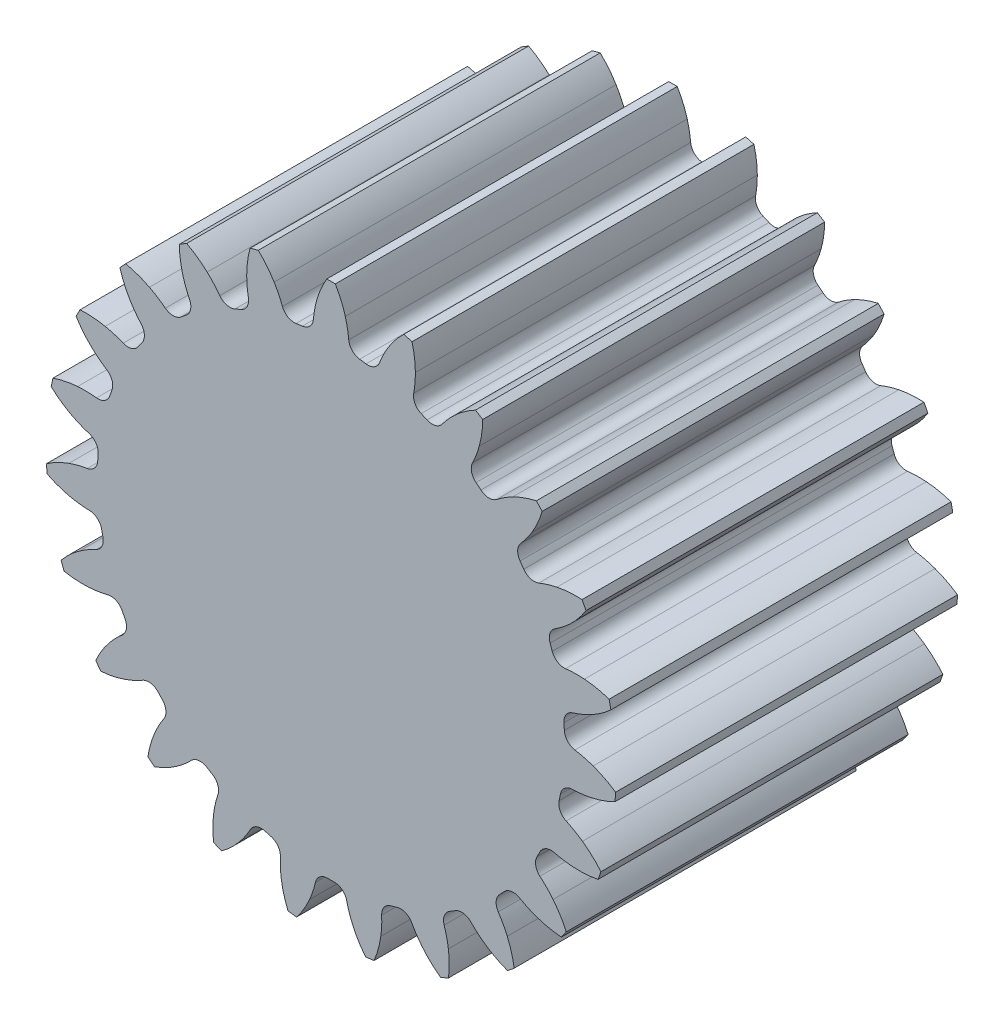
from build123d import *

# Parameters (mm, degrees)
BOSS_EXTRUDE1_DEPTH = 60


with BuildPart() as part:
    # Sketch1 → Boss-Extrude1 (new body)
    with BuildSketch(Plane.XY):
        with BuildLine():
            ThreePointArc((-5.026149362, 40.690758442), (-5.582832613, 40.618123787), (-6.138469134, 40.537873608))
            ThreePointArc((-6.138469134, 40.537873608), (-7.575957247, 40.812524235), (-8.523084033, 41.928210523))
            ThreePointArc((-8.523084033, 41.928210523), (-9.185611931, 43.449347612), (-9.985016116, 44.903223194))
            ThreePointArc((-9.985016116, 44.903223194), (-11.262557951, 46.714390419), (-12.7661329, 48.342795231))
            ThreePointArc((-12.7661329, 48.342795231), (-13.489838558, 48.145864367), (-14.210508831, 47.938100075))
            ThreePointArc((-14.210508831, 47.938100075), (-14.64909944, 45.765525993), (-14.799602552, 43.554239338))
            ThreePointArc((-14.799602552, 43.554239338), (-14.727218582, 41.896662245), (-14.502936857, 40.252734337))
            ThreePointArc((-14.502936857, 40.252734337), (-14.732487673, 38.807358447), (-15.818001353, 37.82579587))
            ThreePointArc((-15.818001353, 37.82579587), (-16.334444684, 37.605663362), (-16.847825456, 37.378480138))
            ThreePointArc((-16.847825456, 37.378480138), (-18.306107463, 37.255116323), (-19.519120776, 38.073898188))
            ThreePointArc((-19.519120776, 38.073898188), (-20.567478217, 39.359879499), (-21.729489264, 40.544164763))
            ThreePointArc((-21.729489264, 40.544164763), (-23.448303452, 41.943492333), (-25.335460124, 43.10585181))
            ThreePointArc((-25.335460124, 43.10585181), (-25.979197502, 42.720970227), (-26.617089231, 42.326475885))
            ThreePointArc((-26.617089231, 42.326475885), (-26.453262238, 40.116136414), (-26.001586287, 37.946245013))
            ThreePointArc((-26.001586287, 37.946245013), (-25.484677563, 36.369664336), (-24.825186371, 34.84720822))
            ThreePointArc((-24.825186371, 34.84720822), (-24.656267072, 33.393498719), (-25.436704546, 32.15546706))
            ThreePointArc((-25.436704546, 32.15546706), (-25.874605717, 31.804162919), (-26.307655638, 31.44689579))
            ThreePointArc((-26.307655638, 31.44689579), (-27.678577433, 30.934666863), (-29.067513626, 31.395819))
            ThreePointArc((-29.067513626, 31.395819), (-30.423948735, 32.351269184), (-31.8623856, 33.178131109))
            ThreePointArc((-31.8623856, 33.178131109), (-33.894995555, 34.061837298), (-36.025772173, 34.671944557))
            ThreePointArc((-36.025772173, 34.671944557), (-36.541798214, 34.127657161), (-37.049601888, 33.57569061))
            ThreePointArc((-37.049601888, 33.57569061), (-36.295507592, 31.491516517), (-35.275151316, 29.523951287))
            ThreePointArc((-35.275151316, 29.523951287), (-34.352054594, 28.145294804), (-33.30626538, 26.857224084))
            ThreePointArc((-33.30626538, 26.857224084), (-32.751403937, 25.502995957), (-33.168883729, 24.100314359))
            ThreePointArc((-33.168883729, 24.100314359), (-33.495765613, 23.643893207), (-33.81636735, 23.183039042))
            ThreePointArc((-33.81636735, 23.183039042), (-34.998253936, 22.319934679), (-36.460101965, 22.389255544))
            ThreePointArc((-36.460101965, 22.389255544), (-38.024014155, 22.94331323), (-39.632194557, 23.35142725))
            ThreePointArc((-39.632194557, 23.35142725), (-41.827850898, 23.653971614), (-44.044217507, 23.666577789))
            ThreePointArc((-44.044217507, 23.666577789), (-44.39426092, 23.003251887), (-44.734315063, 22.334749961))
            ThreePointArc((-44.734315063, 22.334749961), (-43.445881188, 20.531314903), (-41.932519745, 18.912001158))
            ThreePointArc((-41.932519745, 18.912001158), (-40.671696886, 17.833517512), (-39.317171052, 16.875362502))
            ThreePointArc((-39.317171052, 16.875362502), (-38.417519, 15.721052653), (-38.441078542, 14.257751594))
            ThreePointArc((-38.441078542, 14.257751594), (-38.632697807, 13.730064099), (-38.817073796, 13.199802344))
            ThreePointArc((-38.817073796, 13.199802344), (-39.722270051, 12.049835047), (-41.148611335, 11.722183428))
            ThreePointArc((-41.148611335, 11.722183428), (-42.804012393, 11.833756693), (-44.462664948, 11.792854858))
            ThreePointArc((-44.462664948, 11.792854858), (-46.658525889, 11.491799065), (-48.796104717, 10.905969214))
            ThreePointArc((-48.796104717, 10.905969214), (-48.954204384, 10.172800653), (-49.101288736, 9.437343082))
            ThreePointArc((-49.101288736, 9.437343082), (-47.374072528, 8.048399587), (-45.479945013, 6.89743442))
            ThreePointArc((-45.479945013, 6.89743442), (-43.97490548, 6.199109809), (-42.41210201, 5.641932483))
            ThreePointArc((-42.41210201, 5.641932483), (-41.234382427, 4.773150793), (-40.862274417, 3.357756618))
            ThreePointArc((-40.862274417, 3.357756618), (-40.904419537, 2.797938948), (-40.938895455, 2.23759669))
            ThreePointArc((-40.938895455, 2.23759669), (-41.500267113, 0.886054274), (-42.785316444, 0.185730593))
            ThreePointArc((-42.785316444, 0.185730593), (-44.409432848, -0.153455442), (-45.995542884, -0.64033963))
            ThreePointArc((-45.995542884, -0.64033963), (-48.028751463, -1.522667649), (-49.929008067, -2.663485206))
            ThreePointArc((-49.929008067, -2.663485206), (-49.88343846, -3.412120668), (-49.826644447, -4.15998836))
            ThreePointArc((-49.826644447, -4.15998836), (-47.788745631, -5.031428706), (-45.654330817, -5.628683476))
            ThreePointArc((-45.654330817, -5.628683476), (-44.016696507, -5.895057509), (-42.361521386, -6.009933859))
            ThreePointArc((-42.361521386, -6.009933859), (-40.993080344, -6.528753826), (-40.25290233, -7.791267806))
            ThreePointArc((-40.25290233, -7.791267806), (-40.142447595, -8.341696535), (-40.02446652, -8.890561273))
            ThreePointArc((-40.02446652, -8.890561273), (-40.200379215, -10.343441091), (-41.248830363, -11.364497031))
            ThreePointArc((-41.248830363, -11.364497031), (-42.721208828, -12.129286489), (-44.117141819, -13.026043057))
            ThreePointArc((-44.117141819, -13.026043057), (-45.836904258, -14.42420507), (-47.358905299, -16.035401113))
            ThreePointArc((-47.358905299, -16.035401113), (-47.113046106, -16.743980609), (-46.856585881, -17.448792496))
            ThreePointArc((-46.856585881, -17.448792496), (-44.65914609, -17.738098951), (-42.442743758, -17.737347668))
            ThreePointArc((-42.442743758, -17.737347668), (-40.793970517, -17.55201538), (-39.169180511, -17.216070899))
            ThreePointArc((-39.169180511, -17.216070899), (-37.711509023, -17.346450641), (-36.658156622, -18.362449539))
            ThreePointArc((-36.658156622, -18.362449539), (-36.403293954, -18.862666547), (-36.141606004, -19.359346979))
            ThreePointArc((-36.141606004, -19.359346979), (-35.919013095, -20.805810749), (-36.653107234, -22.071871899))
            ThreePointArc((-36.653107234, -22.071871899), (-37.864548185, -23.205543845), (-38.966774168, -24.445664461))
            ThreePointArc((-38.966774168, -24.445664461), (-40.245543554, -26.255965186), (-41.276409178, -28.218044677))
            ThreePointArc((-41.276409178, -28.218044677), (-40.848494651, -28.834016106), (-40.411388695, -29.443499516))
            ThreePointArc((-40.411388695, -29.443499516), (-38.217381985, -29.129215542), (-36.083372558, -28.530513926))
            ThreePointArc((-36.083372558, -28.530513926), (-34.545742353, -27.907220565), (-33.071840704, -27.14537072))
            ThreePointArc((-33.071840704, -27.14537072), (-31.633047597, -26.877640566), (-30.344643138, -27.571772392))
            ThreePointArc((-30.344643138, -27.571772392), (-29.964274535, -27.984678872), (-29.578287907, -28.392338482))
            ThreePointArc((-29.578287907, -28.392338482), (-28.973698092, -29.725108604), (-29.338990819, -31.142277001))
            ThreePointArc((-29.338990819, -31.142277001), (-30.199647223, -32.560752173), (-30.926419138, -34.052262763))
            ThreePointArc((-30.926419138, -34.052262763), (-31.669354996, -36.140440478), (-32.132630615, -38.307884955))
            ThreePointArc((-32.132630615, -38.307884955), (-31.554397216, -38.785564535), (-30.969063679, -39.254516872))
            ThreePointArc((-30.969063679, -39.254516872), (-28.941209491, -38.359951474), (-27.047862685, -37.207702485))
            ThreePointArc((-27.047862685, -37.207702485), (-25.735414516, -36.192674868), (-24.521713766, -35.061422576))
            ThreePointArc((-24.521713766, -35.061422576), (-23.208507741, -34.415438847), (-21.780606289, -34.73622302))
            ThreePointArc((-21.780606289, -34.73622302), (-21.302941951, -35.031195586), (-20.821283508, -35.319600126))
            ThreePointArc((-20.821283508, -35.319600126), (-19.879536448, -36.439831137), (-19.848935672, -37.903001883))
            ThreePointArc((-19.848935672, -37.903001883), (-20.29497658, -39.501078467), (-20.59239308, -41.133360515))
            ThreePointArc((-20.59239308, -41.133360515), (-20.744395256, -43.344544632), (-20.605721836, -45.556604654))
            ThreePointArc((-20.605721836, -45.556604654), (-19.920054492, -45.860565075), (-19.229904884, -46.154206289))
            ThreePointArc((-19.229904884, -46.154206289), (-17.518599886, -44.74570529), (-16.006336573, -43.125365964))
            ThreePointArc((-16.006336573, -43.125365964), (-15.016408715, -41.793884047), (-14.152923498, -40.377129115))
            ThreePointArc((-14.152923498, -40.377129115), (-13.062699039, -39.40080147), (-11.601201512, -39.324446894))
            ThreePointArc((-11.601201512, -39.324446894), (-11.061667617, -39.479608781), (-10.520059762, -39.627368606))
            ThreePointArc((-10.520059762, -39.627368606), (-9.311000528, -40.451978095), (-8.886775769, -41.852634511))
            ThreePointArc((-8.886775769, -41.852634511), (-8.885120368, -43.511790477), (-8.731123431, -45.16378509))
            ThreePointArc((-8.731123431, -45.16378509), (-8.280918618, -47.333982198), (-7.550580934, -49.426599393))
            ThreePointArc((-7.550580934, -49.426599393), (-6.808332455, -49.534297302), (-6.064552015, -49.630849367))
            ThreePointArc((-6.064552015, -49.630849367), (-4.79671587, -47.812874843), (-3.777693701, -45.844618335))
            ThreePointArc((-3.777693701, -45.844618335), (-3.183704576, -44.29543204), (-2.734475639, -42.6982487))
            ThreePointArc((-2.734475639, -42.6982487), (-1.948089706, -41.463986894), (-0.56138869, -40.996156439))
            ThreePointArc((-0.56138869, -40.996156439), (0, -41), (0.56138869, -40.996156439))
            ThreePointArc((0.56138869, -40.996156439), (1.948089706, -41.463986894), (2.734475639, -42.6982487))
            ThreePointArc((2.734475639, -42.6982487), (3.183704576, -44.29543204), (3.777693701, -45.844618335))
            ThreePointArc((3.777693701, -45.844618335), (4.79671587, -47.812874843), (6.064552015, -49.630849367))
            ThreePointArc((6.064552015, -49.630849367), (6.808332455, -49.534297302), (7.550580934, -49.426599393))
            ThreePointArc((7.550580934, -49.426599393), (8.280918618, -47.333982198), (8.731123431, -45.16378509))
            ThreePointArc((8.731123431, -45.16378509), (8.885120368, -43.511790477), (8.886775769, -41.852634511))
            ThreePointArc((8.886775769, -41.852634511), (9.311000528, -40.451978095), (10.520059762, -39.627368606))
            ThreePointArc((10.520059762, -39.627368606), (11.061667617, -39.479608781), (11.601201512, -39.324446894))
            ThreePointArc((11.601201512, -39.324446894), (13.062699039, -39.40080147), (14.152923498, -40.377129115))
            ThreePointArc((14.152923498, -40.377129115), (15.016408715, -41.793884047), (16.006336573, -43.125365964))
            ThreePointArc((16.006336573, -43.125365964), (17.518599886, -44.74570529), (19.229904884, -46.154206289))
            ThreePointArc((19.229904884, -46.154206289), (19.920054492, -45.860565075), (20.605721836, -45.556604654))
            ThreePointArc((20.605721836, -45.556604654), (20.744395256, -43.344544632), (20.59239308, -41.133360515))
            ThreePointArc((20.59239308, -41.133360515), (20.29497658, -39.501078467), (19.848935672, -37.903001883))
            ThreePointArc((19.848935672, -37.903001883), (19.879536448, -36.439831137), (20.821283508, -35.319600126))
            ThreePointArc((20.821283508, -35.319600126), (21.302941951, -35.031195586), (21.780606289, -34.73622302))
            ThreePointArc((21.780606289, -34.73622302), (23.208507741, -34.415438847), (24.521713766, -35.061422576))
            ThreePointArc((24.521713766, -35.061422576), (25.735414516, -36.192674868), (27.047862685, -37.207702485))
            ThreePointArc((27.047862685, -37.207702485), (28.941209491, -38.359951474), (30.969063679, -39.254516872))
            ThreePointArc((30.969063679, -39.254516872), (31.554397216, -38.785564535), (32.132630615, -38.307884955))
            ThreePointArc((32.132630615, -38.307884955), (31.669354996, -36.140440478), (30.926419138, -34.052262763))
            ThreePointArc((30.926419138, -34.052262763), (30.199647223, -32.560752173), (29.338990819, -31.142277001))
            ThreePointArc((29.338990819, -31.142277001), (28.973698092, -29.725108604), (29.578287907, -28.392338482))
            ThreePointArc((29.578287907, -28.392338482), (29.964274535, -27.984678872), (30.344643138, -27.571772392))
            ThreePointArc((30.344643138, -27.571772392), (31.633047597, -26.877640566), (33.071840704, -27.14537072))
            ThreePointArc((33.071840704, -27.14537072), (34.545742353, -27.907220565), (36.083372558, -28.530513926))
            ThreePointArc((36.083372558, -28.530513926), (38.217381985, -29.129215542), (40.411388695, -29.443499516))
            ThreePointArc((40.411388695, -29.443499516), (40.848494651, -28.834016106), (41.276409178, -28.218044677))
            ThreePointArc((41.276409178, -28.218044677), (40.245543554, -26.255965186), (38.966774168, -24.445664461))
            ThreePointArc((38.966774168, -24.445664461), (37.864548185, -23.205543845), (36.653107234, -22.071871899))
            ThreePointArc((36.653107234, -22.071871899), (35.919013095, -20.805810749), (36.141606004, -19.359346979))
            ThreePointArc((36.141606004, -19.359346979), (36.403293954, -18.862666547), (36.658156622, -18.362449539))
            ThreePointArc((36.658156622, -18.362449539), (37.711509023, -17.346450641), (39.169180511, -17.216070899))
            ThreePointArc((39.169180511, -17.216070899), (40.793970517, -17.55201538), (42.442743758, -17.737347668))
            ThreePointArc((42.442743758, -17.737347668), (44.65914609, -17.738098951), (46.856585881, -17.448792496))
            ThreePointArc((46.856585881, -17.448792496), (47.113046106, -16.743980609), (47.358905299, -16.035401113))
            ThreePointArc((47.358905299, -16.035401113), (45.836904258, -14.42420507), (44.117141819, -13.026043057))
            ThreePointArc((44.117141819, -13.026043057), (42.721208828, -12.129286489), (41.248830363, -11.364497031))
            ThreePointArc((41.248830363, -11.364497031), (40.200379215, -10.343441091), (40.02446652, -8.890561273))
            ThreePointArc((40.02446652, -8.890561273), (40.142447595, -8.341696535), (40.25290233, -7.791267806))
            ThreePointArc((40.25290233, -7.791267806), (40.993080344, -6.528753826), (42.361521386, -6.009933859))
            ThreePointArc((42.361521386, -6.009933859), (44.016696507, -5.895057509), (45.654330817, -5.628683476))
            ThreePointArc((45.654330817, -5.628683476), (47.788745631, -5.031428706), (49.826644447, -4.15998836))
            ThreePointArc((49.826644447, -4.15998836), (49.88343846, -3.412120668), (49.929008067, -2.663485206))
            ThreePointArc((49.929008067, -2.663485206), (48.028751463, -1.522667649), (45.995542884, -0.64033963))
            ThreePointArc((45.995542884, -0.64033963), (44.409432848, -0.153455442), (42.785316444, 0.185730593))
            ThreePointArc((42.785316444, 0.185730593), (41.500267113, 0.886054274), (40.938895455, 2.23759669))
            ThreePointArc((40.938895455, 2.23759669), (40.904419537, 2.797938948), (40.862274417, 3.357756618))
            ThreePointArc((40.862274417, 3.357756618), (41.234382427, 4.773150793), (42.41210201, 5.641932483))
            ThreePointArc((42.41210201, 5.641932483), (43.97490548, 6.199109809), (45.479945013, 6.89743442))
            ThreePointArc((45.479945013, 6.89743442), (47.374072528, 8.048399587), (49.101288736, 9.437343082))
            ThreePointArc((49.101288736, 9.437343082), (48.954204384, 10.172800653), (48.796104717, 10.905969214))
            ThreePointArc((48.796104717, 10.905969214), (46.658525889, 11.491799065), (44.462664948, 11.792854858))
            ThreePointArc((44.462664948, 11.792854858), (42.804012393, 11.833756693), (41.148611335, 11.722183428))
            ThreePointArc((41.148611335, 11.722183428), (39.722270051, 12.049835047), (38.817073796, 13.199802344))
            ThreePointArc((38.817073796, 13.199802344), (38.632697807, 13.730064099), (38.441078542, 14.257751594))
            ThreePointArc((38.441078542, 14.257751594), (38.417519, 15.721052653), (39.317171052, 16.875362502))
            ThreePointArc((39.317171052, 16.875362502), (40.671696886, 17.833517512), (41.932519745, 18.912001158))
            ThreePointArc((41.932519745, 18.912001158), (43.445881188, 20.531314903), (44.734315063, 22.334749961))
            ThreePointArc((44.734315063, 22.334749961), (44.39426092, 23.003251887), (44.044217507, 23.666577789))
            ThreePointArc((44.044217507, 23.666577789), (41.827850898, 23.653971614), (39.632194557, 23.35142725))
            ThreePointArc((39.632194557, 23.35142725), (38.024014155, 22.94331323), (36.460101965, 22.389255544))
            ThreePointArc((36.460101965, 22.389255544), (34.998253936, 22.319934679), (33.81636735, 23.183039042))
            ThreePointArc((33.81636735, 23.183039042), (33.495765613, 23.643893207), (33.168883729, 24.100314359))
            ThreePointArc((33.168883729, 24.100314359), (32.751403937, 25.502995957), (33.30626538, 26.857224084))
            ThreePointArc((33.30626538, 26.857224084), (34.352054594, 28.145294804), (35.275151316, 29.523951287))
            ThreePointArc((35.275151316, 29.523951287), (36.295507592, 31.491516517), (37.049601888, 33.57569061))
            ThreePointArc((37.049601888, 33.57569061), (36.541798214, 34.127657161), (36.025772173, 34.671944557))
            ThreePointArc((36.025772173, 34.671944557), (33.894995555, 34.061837298), (31.8623856, 33.178131109))
            ThreePointArc((31.8623856, 33.178131109), (30.423948735, 32.351269184), (29.067513626, 31.395819))
            ThreePointArc((29.067513626, 31.395819), (27.678577433, 30.934666863), (26.307655638, 31.44689579))
            ThreePointArc((26.307655638, 31.44689579), (25.874605717, 31.804162919), (25.436704546, 32.15546706))
            ThreePointArc((25.436704546, 32.15546706), (24.656267072, 33.393498719), (24.825186371, 34.84720822))
            ThreePointArc((24.825186371, 34.84720822), (25.484677563, 36.369664336), (26.001586287, 37.946245013))
            ThreePointArc((26.001586287, 37.946245013), (26.453262238, 40.116136414), (26.617089231, 42.326475885))
            ThreePointArc((26.617089231, 42.326475885), (25.979197502, 42.720970227), (25.335460124, 43.10585181))
            ThreePointArc((25.335460124, 43.10585181), (23.448303452, 41.943492333), (21.729489264, 40.544164763))
            ThreePointArc((21.729489264, 40.544164763), (20.567478217, 39.359879499), (19.519120776, 38.073898188))
            ThreePointArc((19.519120776, 38.073898188), (18.306107463, 37.255116323), (16.847825456, 37.378480138))
            ThreePointArc((16.847825456, 37.378480138), (16.334444684, 37.605663362), (15.818001353, 37.82579587))
            ThreePointArc((15.818001353, 37.82579587), (14.732487673, 38.807358447), (14.502936857, 40.252734337))
            ThreePointArc((14.502936857, 40.252734337), (14.727218582, 41.896662245), (14.799602552, 43.554239338))
            ThreePointArc((14.799602552, 43.554239338), (14.64909944, 45.765525993), (14.210508831, 47.938100075))
            ThreePointArc((14.210508831, 47.938100075), (13.489838558, 48.145864367), (12.7661329, 48.342795231))
            ThreePointArc((12.7661329, 48.342795231), (11.262557951, 46.714390419), (9.985016116, 44.903223194))
            ThreePointArc((9.985016116, 44.903223194), (9.185611931, 43.449347612), (8.523084033, 41.928210523))
            ThreePointArc((8.523084033, 41.928210523), (7.575957247, 40.812524235), (6.138469134, 40.537873608))
            ThreePointArc((6.138469134, 40.537873608), (5.582832613, 40.618123787), (5.026149362, 40.690758442))
            ThreePointArc((5.026149362, 40.690758442), (3.71606706, 41.34305393), (3.105070862, 42.672899292))
            ThreePointArc((3.105070862, 42.672899292), (2.877509172, 44.316376379), (2.5, 45.932014979))
            ThreePointArc((2.5, 45.932014979), (1.758479951, 48.020695873), (0.75, 49.994374684))
            ThreePointArc((0.75, 49.994374684), (0, 50), (-0.75, 49.994374684))
            ThreePointArc((-0.75, 49.994374684), (-1.758479951, 48.020695873), (-2.5, 45.932014979))
            ThreePointArc((-2.5, 45.932014979), (-2.877509172, 44.316376379), (-3.105070862, 42.672899292))
            ThreePointArc((-3.105070862, 42.672899292), (-3.71606706, 41.34305393), (-5.026149362, 40.690758442))
        make_face()
    extrude(amount=BOSS_EXTRUDE1_DEPTH)


solid = part.part
